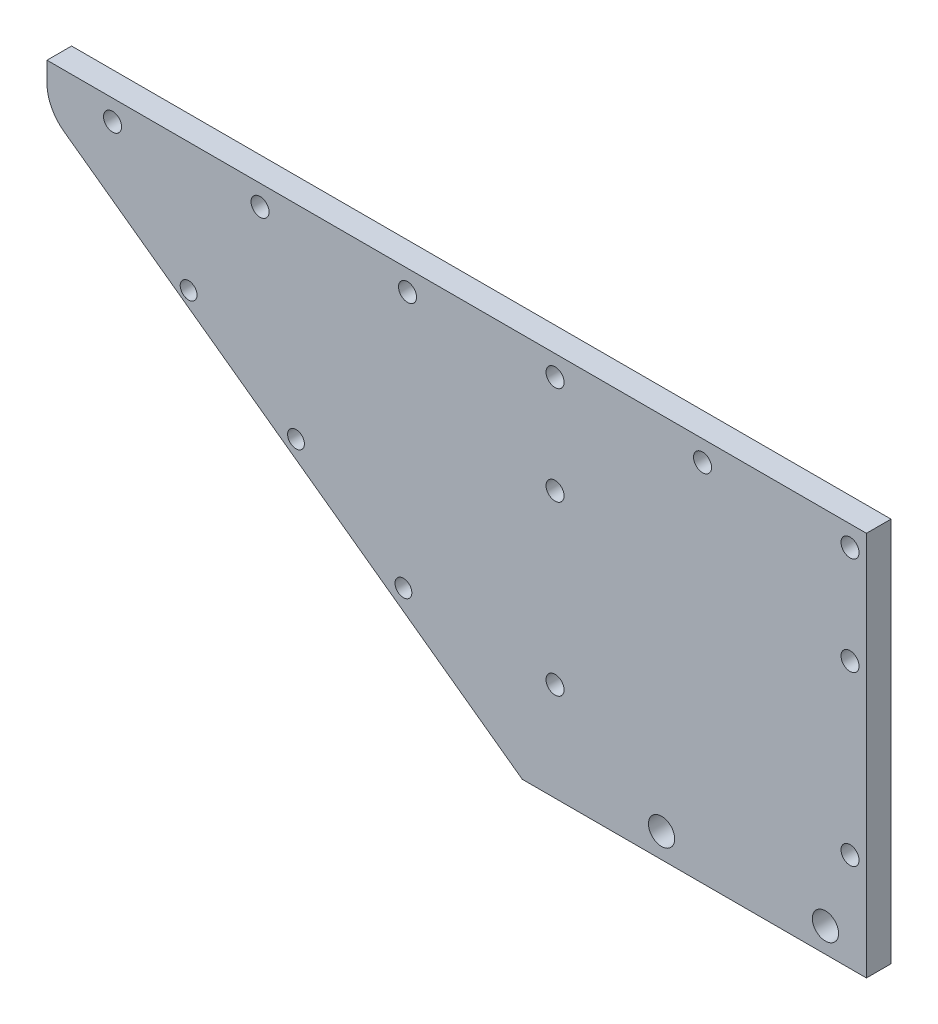
from build123d import *

# Parameters (mm, degrees)
EXTRUDE_1_DEPTH     = 3
SKETCH_2_R          = 1.1
SKETCH_2_R_2        = 1.025013192
SKETCH_2_R_3        = 1.6
CUT_EXTRUDE_2_DEPTH = 111.535062311
FILLET_1_R          = 5


with BuildPart() as part:
    # 草图1 → 凸台-拉伸1 (new body)
    with BuildSketch(Plane.XY):
        Polygon((0, 0), (0, -47), (-42, -47), (-100, -5), (-100, 0), align=None)
    extrude(amount=EXTRUDE_1_DEPTH)

    # 草图2 → 切除-拉伸2 (cut, through all)
    with BuildSketch(Plane.XY.offset(3)):
        with Locations(Location((-38, -35, 0), (0, 0, 180))):
            Circle(SKETCH_2_R)
        with Locations(Location((-38, -14.5, 0), (0, 0, 180))):
            Circle(SKETCH_2_R)
        with Locations(Location((-38, -2.5, 0), (0, 0, 180))):
            Circle(SKETCH_2_R)
        with Locations(Location((-56, -2.5, 0), (0, 0, 180))):
            Circle(SKETCH_2_R)
        with Locations(Location((-74, -2.5, 0), (0, 0, 180))):
            Circle(SKETCH_2_R)
        with Locations(Location((-92, -2.5, 0), (0, 0, 180))):
            Circle(SKETCH_2_R)
        with Locations((-56.501870582, -34.029333193)):
            Circle(SKETCH_2_R_2)
        with Locations((-69.609581311, -24.853935684)):
            Circle(SKETCH_2_R_2)
        with Locations((-82.717292039, -15.678538174)):
            Circle(SKETCH_2_R_2)
        with Locations((-20, -2.5)):
            Circle(SKETCH_2_R)
        with Locations((-2, -2.5)):
            Circle(SKETCH_2_R)
        with Locations((-2, -14.5)):
            Circle(SKETCH_2_R)
        with Locations((-2, -35)):
            Circle(SKETCH_2_R)
        with Locations((-5, -44)):
            Circle(SKETCH_2_R_3)
        with Locations((-25, -44)):
            Circle(SKETCH_2_R_3)
    extrude(amount=-CUT_EXTRUDE_2_DEPTH, mode=Mode.SUBTRACT)

    # 圆角1
    fillet_1_edges = [part.edges().sort_by_distance(p)[0] for p in [
        (-100, -5, 1.5),
    ]]
    fillet(fillet_1_edges, radius=FILLET_1_R)


solid = part.part
